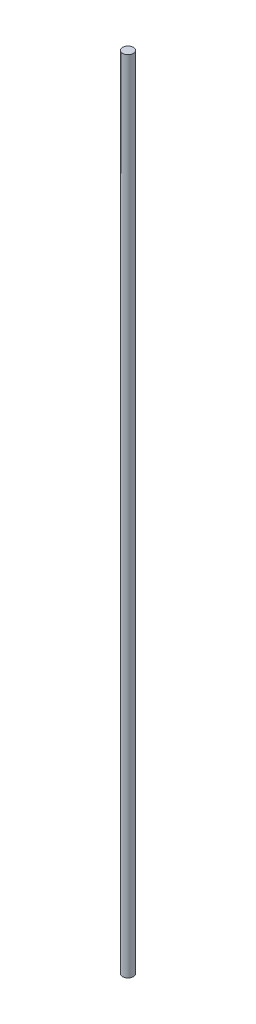
from build123d import *

# Parameters (mm, degrees)
SKETCH1_R           = 2
BOSS_EXTRUDE1_DEPTH = 300


with BuildPart() as part:
    # Sketch1 → Boss-Extrude1 (new body)
    with BuildSketch(Plane(origin=(0, 0, 0), x_dir=(1, 0, 0), z_dir=(0, 1, 0))):
        with Locations(Location((0, 0, 0), (0, 0, 270))):
            Circle(SKETCH1_R)
    extrude(amount=BOSS_EXTRUDE1_DEPTH)


solid = part.part
